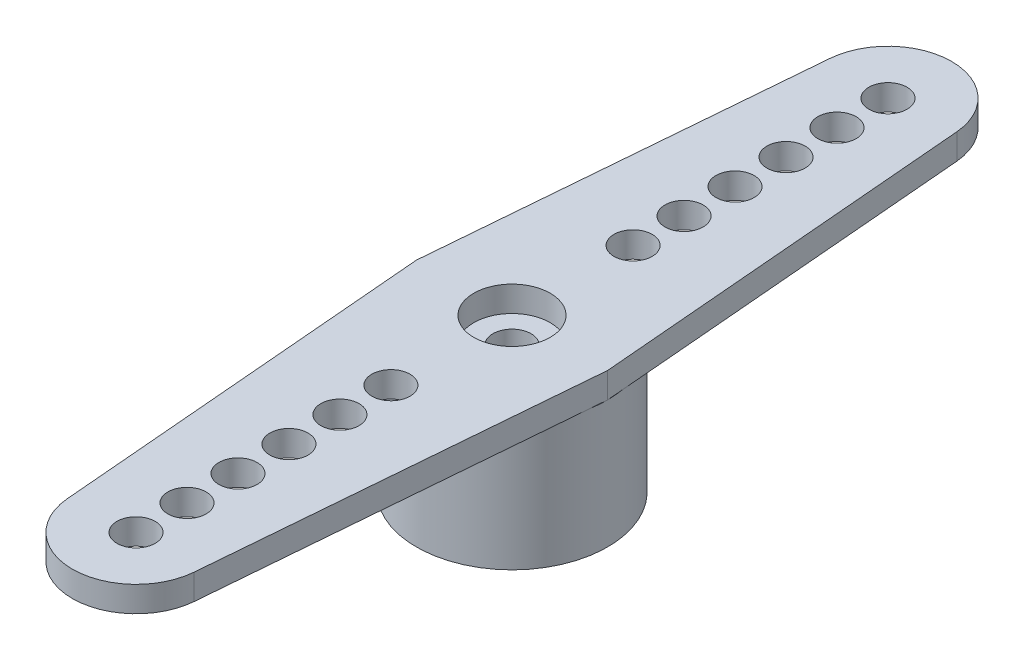
from build123d import *

# Parameters (mm, degrees)
SKETCH1_R           = 0.75
BOSS_EXTRUDE1_DEPTH = 1
SKETCH3_R           = 3.75
BOSS_EXTRUDE2_DEPTH = 5
SKETCH3_3_R         = 1.5
CUT_EXTRUDE1_DEPTH  = 19.347343132
SKETCH1_2_R         = 0.75
CUT_EXTRUDE2_DEPTH  = 19.347343132
SKETCH4_R           = 2.355
CUT_EXTRUDE3_DEPTH  = 2
CUT_EXTRUDE4_DEPTH  = 2
CIRPATTERN1_COUNT   = 56


with BuildPart() as part:
    # Sketch1 → Boss-Extrude1 (new body)
    with BuildSketch(Plane(origin=(0, 0, 0), x_dir=(1, 0, 0), z_dir=(0, 1, 0))):
        with BuildLine():
            Line((-2.49119588, 14.959626071), (-3.75, 0))
            Line((-3.75, 0), (-2.49119588, -14.959626071))
            ThreePointArc((-2.49119588, -14.959626071), (0, -17.25), (2.49119588, -14.959626071))
            Line((2.49119588, -14.959626071), (3.75, 0))
            Line((3.75, 0), (2.49119588, 14.959626071))
            ThreePointArc((2.49119588, 14.959626071), (0, 17.25), (-2.49119588, 14.959626071))
        make_face()
        with Locations(Location((0, 14.75, 0), (0, 0, 270))):
            Circle(SKETCH1_R, mode=Mode.SUBTRACT)
        with Locations(Location((0, 12.75, 0), (0, 0, 270))):
            Circle(SKETCH1_R, mode=Mode.SUBTRACT)
        with Locations(Location((0, 10.75, 0), (0, 0, 270))):
            Circle(SKETCH1_R, mode=Mode.SUBTRACT)
        with Locations(Location((0, 8.75, 0), (0, 0, 270))):
            Circle(SKETCH1_R, mode=Mode.SUBTRACT)
        with Locations(Location((0, 6.75, 0), (0, 0, 270))):
            Circle(SKETCH1_R, mode=Mode.SUBTRACT)
        with Locations(Location((0, 4.75, 0), (0, 0, 270))):
            Circle(SKETCH1_R, mode=Mode.SUBTRACT)
        with Locations(Location((0, 0, 0), (0, 0, 270))):
            Circle(SKETCH1_R, mode=Mode.SUBTRACT)
        with Locations(Location((0, -14.75, 0), (0, 0, 90))):
            Circle(SKETCH1_R, mode=Mode.SUBTRACT)
        with Locations(Location((0, -12.75, 0), (0, 0, 90))):
            Circle(SKETCH1_R, mode=Mode.SUBTRACT)
        with Locations(Location((0, -10.75, 0), (0, 0, 90))):
            Circle(SKETCH1_R, mode=Mode.SUBTRACT)
        with Locations(Location((0, -8.75, 0), (0, 0, 90))):
            Circle(SKETCH1_R, mode=Mode.SUBTRACT)
        with Locations(Location((0, -6.75, 0), (0, 0, 90))):
            Circle(SKETCH1_R, mode=Mode.SUBTRACT)
        with Locations(Location((0, -4.75, 0), (0, 0, 90))):
            Circle(SKETCH1_R, mode=Mode.SUBTRACT)
    extrude(amount=BOSS_EXTRUDE1_DEPTH)

    # Sketch3 → Boss-Extrude2 (add)
    with BuildSketch(Plane.XZ):
        with Locations(Location((0, 0, 0), (0, 0, 9.619846544))):
            Circle(SKETCH3_R)
    extrude(amount=BOSS_EXTRUDE2_DEPTH)

    # Sketch3<3> → Cut-Extrude1 (cut, through all)
    with BuildSketch(Plane.XZ):
        with Locations(Location((0, 0, 0), (0, 0, 270))):
            Circle(SKETCH3_3_R)
    extrude(amount=-CUT_EXTRUDE1_DEPTH, mode=Mode.SUBTRACT)

    # Sketch1<2> → Cut-Extrude2 (cut, through all)
    with BuildSketch(Plane(origin=(0, 0, 0), x_dir=(1, 0, 0), z_dir=(0, 1, 0))):
        with Locations(Location((0, 0, 0), (0, 0, 270))):
            Circle(SKETCH1_2_R)
    extrude(amount=-CUT_EXTRUDE2_DEPTH, mode=Mode.SUBTRACT)

    # Sketch4 → Cut-Extrude3 (cut)
    with BuildSketch(Plane.XZ.offset(5)):
        with Locations(Location((0, 0, 0), (0, 0, 270))):
            Circle(SKETCH4_R)
    extrude(amount=-CUT_EXTRUDE3_DEPTH, mode=Mode.SUBTRACT)

    # Sketch5 → Cut-Extrude4 (cut)
    with BuildSketch(Plane.XZ.offset(5)):
        with BuildLine():
            Line((-0.141421356, 2.35074988), (0, 2.492171237))
            Line((0, 2.492171237), (0.141421356, 2.35074988))
            ThreePointArc((0.141421356, 2.35074988), (0, 2.355), (-0.141421356, 2.35074988))
        make_face()
    cut_extrude4 = extrude(amount=-CUT_EXTRUDE4_DEPTH, mode=Mode.SUBTRACT)

    # CirPattern1: Cut-Extrude4 ×56 about axis
    cirpattern1_axis = Axis((0, 0, 0), (0, 1, 0))
    for i in range(1, CIRPATTERN1_COUNT):
        add(cut_extrude4.rotate(cirpattern1_axis, i * 360 / CIRPATTERN1_COUNT), mode=Mode.SUBTRACT)


solid = part.part
